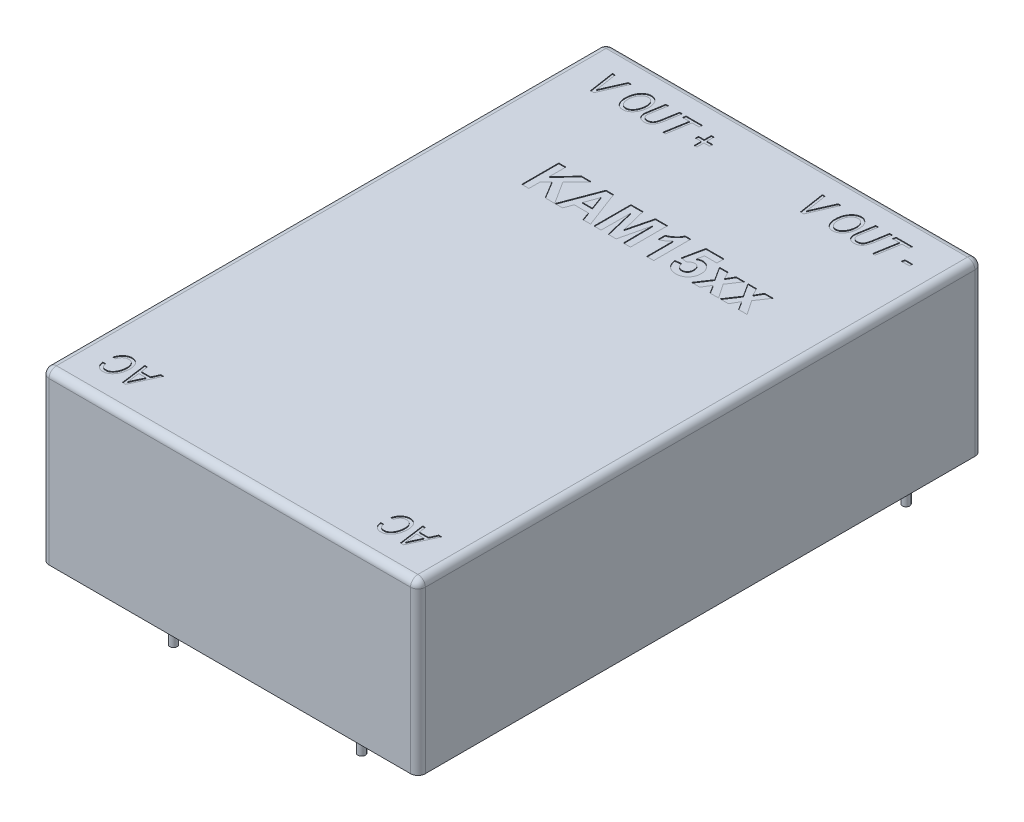
from build123d import *

# Parameters (mm, degrees)
SKETCH_1_W          = 50.8
SKETCH_1_H          = 76.2
EXTRUDE_1_DEPTH     = 22.8
FILLET_1_R          = 1
SKETCH_2_R          = 0.5
EXTRUDE_2_DEPTH     = 6
CUT_EXTRUDE_1_DEPTH = 0.1


with BuildPart() as part:
    # Эскиз1 → Бобышка-Вытянуть1 (new body)
    with BuildSketch(Plane(origin=(0, 0, 0), x_dir=(1, 0, 0), z_dir=(0, 1, 0))):
        Rectangle(SKETCH_1_W, SKETCH_1_H)
    extrude(amount=EXTRUDE_1_DEPTH)

    # Скругление1
    fillet_1_edges = [part.edges().sort_by_distance(p)[0] for p in [
        (-25.4, 22.8, 0),
        (0, 22.8, 38.1),
        (25.4, 22.8, 0),
        (25.4, 11.4, 38.1),
        (-25.4, 11.4, 38.1),
        (-25.4, 11.4, -38.1),
        (25.4, 11.4, -38.1),
        (0, 22.8, -38.1),
    ]]
    fillet(fillet_1_edges, radius=FILLET_1_R)

    # Эскиз2 → Бобышка-Вытянуть2 (add)
    with BuildSketch(Plane.XZ):
        with Locations(Location((-12.7, 33, 0), (0, 0, 270))):
            Circle(SKETCH_2_R)
        with Locations(Location((12.7, 33, 0), (0, 0, 270))):
            Circle(SKETCH_2_R)
        with Locations(Location((-20.3, -32.9, 0), (0, 0, 270))):
            Circle(SKETCH_2_R)
        with Locations(Location((20.3, -32.9, 0), (0, 0, 270))):
            Circle(SKETCH_2_R)
        with Locations(Location((12.7, -22.9, 0), (0, 0, 270))):
            Circle(SKETCH_2_R)
    extrude(amount=EXTRUDE_2_DEPTH)

    # Эскиз4 → Вырез-Вытянуть1 (cut)
    # profile 1 of 21: a face of its own
    with BuildSketch(Plane(origin=(0, 22.8, 0), x_dir=(1, 0, 0), z_dir=(0, 1, 0))):
        with BuildLine():
            Line((-20.508135671, 31.1), (-21.043647035, 34.6))
            Line((-21.043647035, 34.6), (-20.676459535, 34.6))
            Line((-20.676459535, 34.6), (-20.339101581, 32.515482955))
            add(Edge.make_bspline(
                [(-20.339101581, 32.515482955), (-20.331483865, 32.469325449), (-20.316647383, 32.379427772), (-20.295656086, 32.247886285), (-20.278422798, 32.12297363), (-20.261767712, 32.005151321), (-20.247525486, 31.894115019), (-20.235477548, 31.78993832), (-20.225372534, 31.69264127), (-20.220158896, 31.630075275), (-20.217652717, 31.6)],
                knots=[0, 0, 0, 0, 1.215428348, 2.367203002, 3.460592293, 4.49136193, 5.458724188, 6.368902806, 7.215936773, 8, 8, 8, 8], degree=3))
            add(Edge.make_bspline(
                [(-20.217652717, 31.6), (-20.20269006, 31.636912442), (-20.173640112, 31.708577822), (-20.132100289, 31.813321078), (-20.091297327, 31.911344032), (-20.053086857, 32.003158999), (-20.017709037, 32.089117635), (-19.983119768, 32.168249558), (-19.952666314, 32.242189058), (-19.931555804, 32.288737826), (-19.921487944, 32.3109375)],
                knots=[0, 0, 0, 0, 1.24111471, 2.409619975, 3.511069504, 4.549526078, 5.508537314, 6.407443404, 7.240490386, 8, 8, 8, 8], degree=3))
            Line((-19.921487944, 32.3109375), (-18.906573171, 34.6))
            Line((-18.906573171, 34.6), (-18.514527717, 34.6))
            Line((-18.514527717, 34.6), (-20.043647035, 31.1))
            Line((-20.043647035, 31.1), (-20.508135671, 31.1))
        make_face()
    # profile 2 of 21: a face of its own
    with BuildSketch(Plane(origin=(0, 22.8, 0), x_dir=(1, 0, 0), z_dir=(0, 1, 0))):
        with BuildLine():
            add(Edge.make_bspline(
                [(-17.331289081, 32.568039773), (-17.329729, 32.645741847), (-17.326678472, 32.797677857), (-17.304587444, 33.020190907), (-17.26725737, 33.231345515), (-17.214568685, 33.431390348), (-17.147273751, 33.620292149), (-17.064449713, 33.797810306), (-16.967627949, 33.964806365), (-16.89037726, 34.06641638), (-16.851885671, 34.117045455)],
                knots=[0, 0, 0, 0, 1.127803926, 2.205269675, 3.242032255, 4.237287615, 5.204708158, 6.148693905, 7.077552404, 8, 8, 8, 8], degree=3))
            add(Edge.make_bspline(
                [(-16.851885671, 34.117045455), (-16.816226324, 34.158977067), (-16.746363609, 34.241128215), (-16.630446669, 34.349106073), (-16.508435337, 34.440382773), (-16.381083874, 34.515763214), (-16.246963608, 34.573305474), (-16.107639228, 34.616130913), (-15.961859034, 34.640218158), (-15.862859057, 34.64369653), (-15.812823171, 34.645454545)],
                knots=[0, 0, 0, 0, 1.093059416, 2.141488976, 3.139706554, 4.115923473, 5.074573365, 6.032946217, 7.005825244, 8, 8, 8, 8], degree=3))
            add(Edge.make_bspline(
                [(-15.812823171, 34.645454545), (-15.770615129, 34.644249358), (-15.687642854, 34.641880208), (-15.565954227, 34.62248585), (-15.450023093, 34.589078972), (-15.338491425, 34.544742173), (-15.232894603, 34.485785375), (-15.132822546, 34.414078237), (-15.038069231, 34.329613302), (-14.94888847, 34.233257631), (-14.867121973, 34.125797299), (-14.796484325, 34.006759515), (-14.737128845, 33.877818537), (-14.687638689, 33.739135495), (-14.650523454, 33.590125374), (-14.623784004, 33.431274997), (-14.607212909, 33.262517958), (-14.605100601, 33.146677066), (-14.604016353, 33.087215909)],
                knots=[0, 0, 0, 0, 0.916381921, 1.801417193, 2.667292183, 3.532327148, 4.402283747, 5.28688579, 6.201072574, 7.15431746, 8.134323617, 9.128098643, 10.154072632, 11.212764668, 12.321382489, 13.484497127, 14.708791779, 16, 16, 16, 16], degree=3))
            add(Edge.make_bspline(
                [(-14.604016353, 33.087215909), (-14.604691725, 33.038664655), (-14.606030933, 32.942391309), (-14.616913161, 32.799904384), (-14.634671, 32.660751256), (-14.659381437, 32.525084859), (-14.691597769, 32.392900884), (-14.729746043, 32.263688257), (-14.775814432, 32.138205588), (-14.829378269, 32.01722137), (-14.886878686, 31.901233601), (-14.949495096, 31.792518515), (-15.015678411, 31.69127099), (-15.085394058, 31.597354839), (-15.158331141, 31.510189347), (-15.236195309, 31.431386711), (-15.316969183, 31.35922971), (-15.401773192, 31.295599587), (-15.488204683, 31.238627564), (-15.576464038, 31.18934751), (-15.666182207, 31.148319952), (-15.756423161, 31.113819706), (-15.848170159, 31.087432628), (-15.940970705, 31.068267558), (-16.035054126, 31.056443615), (-16.098064311, 31.055178377), (-16.129584535, 31.054545455)],
                knots=[0, 0, 0, 0, 1.243107213, 2.464984574, 3.656776216, 4.833923535, 5.994010872, 7.139048478, 8.282110565, 9.414059015, 10.525597339, 11.595577003, 12.62458755, 13.621214304, 14.589126716, 15.532212535, 16.455509691, 17.35998751, 18.244394592, 19.104641205, 19.945509776, 20.768554808, 21.576275972, 22.387107742, 23.193166529, 24, 24, 24, 24], degree=3))
            add(Edge.make_bspline(
                [(-16.129584535, 31.054545455), (-16.156822212, 31.055175339), (-16.210934125, 31.056426704), (-16.291061539, 31.063859126), (-16.368992252, 31.078646893), (-16.444736489, 31.097579779), (-16.51879516, 31.121715429), (-16.590208662, 31.152571732), (-16.660165993, 31.188033516), (-16.727753364, 31.229165596), (-16.792288919, 31.276584316), (-16.855350605, 31.328034343), (-16.913913804, 31.386601709), (-16.969857605, 31.450462343), (-17.022813436, 31.519714271), (-17.072694102, 31.59478263), (-17.119550371, 31.67522479), (-17.163347661, 31.760726227), (-17.203329042, 31.850617091), (-17.236847996, 31.9443729), (-17.266646935, 32.040638694), (-17.289409438, 32.140502878), (-17.309234571, 32.242922687), (-17.32144698, 32.348820791), (-17.329575816, 32.457353089), (-17.330713526, 32.530855672), (-17.331289081, 32.568039773)],
                knots=[0, 0, 0, 0, 0.908820226, 1.805513784, 2.680768494, 3.552345122, 4.409015119, 5.275999182, 6.144923694, 7.024018507, 7.911868475, 8.814904803, 9.73640305, 10.671074866, 11.645735184, 12.642418782, 13.675972089, 14.749781779, 15.846012825, 16.955338643, 18.069657785, 19.205681351, 20.370577349, 21.548095973, 22.759610301, 24, 24, 24, 24], degree=3))
        make_face()
        with BuildLine():
            add(Edge.make_bspline(
                [(-16.967652717, 32.550994318), (-16.96682723, 32.510716266), (-16.965216101, 32.432104338), (-16.952865645, 32.317197392), (-16.933205495, 32.208403146), (-16.905764307, 32.105532051), (-16.869323964, 32.009307617), (-16.825237758, 31.919310039), (-16.77297865, 31.835484553), (-16.713201458, 31.758580159), (-16.646936504, 31.690529648), (-16.579132272, 31.628998046), (-16.506553871, 31.578750068), (-16.432101767, 31.536034674), (-16.353781351, 31.504309483), (-16.273073046, 31.480179963), (-16.188971226, 31.466873204), (-16.1319939, 31.464720326), (-16.103306126, 31.463636364)],
                knots=[0, 0, 0, 0, 1.248215484, 2.436180984, 3.577521359, 4.672242816, 5.73118744, 6.761629965, 7.77356525, 8.787839044, 9.773903131, 10.714783555, 11.620706577, 12.504486547, 13.369795965, 14.233610676, 15.110632581, 16, 16, 16, 16], degree=3))
            add(Edge.make_bspline(
                [(-16.103306126, 31.463636364), (-16.081013128, 31.464094332), (-16.036469986, 31.46500939), (-15.970094402, 31.475207842), (-15.90385133, 31.488835974), (-15.83803362, 31.509775799), (-15.772908927, 31.537254573), (-15.707147657, 31.568796109), (-15.642575152, 31.607820729), (-15.577859433, 31.65154529), (-15.514434134, 31.701831992), (-15.454212819, 31.759915069), (-15.39565261, 31.824051064), (-15.339914563, 31.894801106), (-15.286809076, 31.972412324), (-15.236853078, 32.056916085), (-15.188484359, 32.147795587), (-15.143172293, 32.244643353), (-15.102503369, 32.346238147), (-15.066055737, 32.450632365), (-15.035406417, 32.557559071), (-15.010762262, 32.66666902), (-14.991325292, 32.778060409), (-14.978229009, 32.891901796), (-14.969224529, 33.008000003), (-14.968178353, 33.086251738), (-14.967652717, 33.125568182)],
                knots=[0, 0, 0, 0, 0.724125538, 1.446859076, 2.178997931, 2.921420815, 3.687522046, 4.475765194, 5.290176887, 6.137665819, 7.013918117, 7.91759318, 8.854671445, 9.835514552, 10.843138707, 11.909652298, 13.025193244, 14.188994346, 15.383812143, 16.581353597, 17.782327931, 18.997814299, 20.216318458, 21.456410356, 22.722010469, 24, 24, 24, 24], degree=3))
            add(Edge.make_bspline(
                [(-14.967652717, 33.125568182), (-14.968583719, 33.167490214), (-14.970401872, 33.249359752), (-14.981240619, 33.368668098), (-15.001789383, 33.48100585), (-15.027811223, 33.586895346), (-15.063847918, 33.685663776), (-15.107185113, 33.777386838), (-15.157536366, 33.862891325), (-15.216730405, 33.939879704), (-15.280981496, 34.009003235), (-15.348636164, 34.070126573), (-15.419971651, 34.121329411), (-15.494153042, 34.164070602), (-15.572488178, 34.195826734), (-15.653506014, 34.219707061), (-15.738274231, 34.233226877), (-15.795732448, 34.235307537), (-15.824897035, 34.236363636)],
                knots=[0, 0, 0, 0, 1.283645288, 2.506830938, 3.662733379, 4.777264101, 5.841126734, 6.875393576, 7.879767937, 8.872779993, 9.842099287, 10.766050559, 11.659182214, 12.525834414, 13.380553688, 14.240756407, 15.107044823, 16, 16, 16, 16], degree=3))
            add(Edge.make_bspline(
                [(-15.824897035, 34.236363636), (-15.858823862, 34.235033272), (-15.926191491, 34.232391601), (-16.026042375, 34.214212878), (-16.123042666, 34.183407698), (-16.217518743, 34.140187044), (-16.309467192, 34.085197741), (-16.398479226, 34.017804191), (-16.484969013, 33.938520288), (-16.538246492, 33.878669602), (-16.565664081, 33.847869318)],
                knots=[0, 0, 0, 0, 0.941820609, 1.870148977, 2.807716515, 3.760800976, 4.74830641, 5.776348317, 6.85566718, 8, 8, 8, 8], degree=3))
            add(Edge.make_bspline(
                [(-16.565664081, 33.847869318), (-16.598066789, 33.806854917), (-16.66309119, 33.724548931), (-16.74480254, 33.587976449), (-16.813661139, 33.441296534), (-16.869920079, 33.283776407), (-16.91360838, 33.115695201), (-16.945690024, 32.936964322), (-16.963957611, 32.747399628), (-16.966400412, 32.617557881), (-16.967652717, 32.550994318)],
                knots=[0, 0, 0, 0, 0.904305924, 1.814723344, 2.748107558, 3.706329986, 4.706586589, 5.751909651, 6.847513167, 8, 8, 8, 8], degree=3))
        make_face(mode=Mode.SUBTRACT)
    # profile 3 of 21: a face of its own
    with BuildSketch(Plane(origin=(0, 22.8, 0), x_dir=(1, 0, 0), z_dir=(0, 1, 0))):
        with BuildLine():
            Line((-13.830578853, 34.6), (-13.461970899, 34.6))
            Line((-13.461970899, 34.6), (-13.824186808, 32.460085227))
            add(Edge.make_bspline(
                [(-13.824186808, 32.460085227), (-13.831055422, 32.419401305), (-13.843810471, 32.343851063), (-13.858071169, 32.238470289), (-13.867493058, 32.149647783), (-13.868976283, 32.095755787), (-13.869641353, 32.071590909)],
                knots=[0, 0, 0, 0, 1.264473255, 2.348132976, 3.259311823, 4, 4, 4, 4], degree=3))
            add(Edge.make_bspline(
                [(-13.869641353, 32.071590909), (-13.869132684, 32.05001587), (-13.868139105, 32.007873557), (-13.85924464, 31.946042401), (-13.845229749, 31.886974914), (-13.825138982, 31.830603832), (-13.799850797, 31.776851276), (-13.767004482, 31.727115247), (-13.730228361, 31.679161851), (-13.687695605, 31.634549334), (-13.640451049, 31.59449458), (-13.58970844, 31.559199555), (-13.535220414, 31.530058736), (-13.477609504, 31.506019707), (-13.416876089, 31.486517072), (-13.352610836, 31.473158973), (-13.285079485, 31.465392159), (-13.238979807, 31.464228494), (-13.215522035, 31.463636364)],
                knots=[0, 0, 0, 0, 1.033877598, 2.01946298, 2.988504879, 3.939836088, 4.884099159, 5.828635058, 6.791274408, 7.778753327, 8.77719556, 9.756354995, 10.736500724, 11.733587211, 12.745868882, 13.789914387, 14.875400268, 16, 16, 16, 16], degree=3))
            add(Edge.make_bspline(
                [(-13.215522035, 31.463636364), (-13.184458842, 31.46437188), (-13.123446142, 31.465816541), (-13.034098345, 31.479672102), (-12.949355929, 31.502398604), (-12.868889069, 31.533757558), (-12.793306542, 31.574681072), (-12.721777855, 31.624060384), (-12.65437571, 31.682304302), (-12.61485935, 31.727570881), (-12.594783399, 31.750568182)],
                knots=[0, 0, 0, 0, 1.052741862, 2.067740481, 3.056983388, 4.022989397, 4.989162175, 5.964496339, 6.965879637, 8, 8, 8, 8], degree=3))
            add(Edge.make_bspline(
                [(-12.594783399, 31.750568182), (-12.579332659, 31.771051811), (-12.546118986, 31.815084433), (-12.504457873, 31.894065662), (-12.463404352, 31.987063406), (-12.424619756, 32.095630399), (-12.38808395, 32.219246068), (-12.353511941, 32.357915384), (-12.320963946, 32.511723837), (-12.301627277, 32.61959153), (-12.291516353, 32.675994318)],
                knots=[0, 0, 0, 0, 0.625993321, 1.345666195, 2.174327788, 3.109296381, 4.159711475, 5.322674786, 6.600057134, 8, 8, 8, 8], degree=3))
            Line((-12.291516353, 32.675994318), (-11.96694249, 34.6))
            Line((-11.96694249, 34.6), (-11.599044762, 34.6))
            Line((-11.599044762, 34.6), (-11.944215217, 32.555965909))
            add(Edge.make_bspline(
                [(-11.944215217, 32.555965909), (-11.95269711, 32.508091228), (-11.969158072, 32.41517998), (-11.997712001, 32.280673229), (-12.028099108, 32.155107238), (-12.060309609, 32.038314051), (-12.096329888, 31.931056551), (-12.132562615, 31.832004918), (-12.172342267, 31.742395758), (-12.214812139, 31.661312691), (-12.25903555, 31.586775626), (-12.306004023, 31.517935886), (-12.354984048, 31.453825143), (-12.406422704, 31.394497114), (-12.460267191, 31.339658703), (-12.517140998, 31.289969022), (-12.576410451, 31.245147376), (-12.657365405, 31.191114526), (-12.76505349, 31.1360262), (-12.902531486, 31.088837572), (-13.047608852, 31.059451223), (-13.147201004, 31.056197466), (-13.197766353, 31.054545455)],
                knots=[0, 0, 0, 0, 1.354048009, 2.627825151, 3.828822134, 4.951889091, 6.000672138, 6.979203555, 7.888343454, 8.72885464, 9.527187123, 10.30076657, 11.048512718, 11.772989406, 12.486339174, 13.187239136, 13.874294499, 14.554577546, 15.89632083, 17.228748768, 18.592968593, 20, 20, 20, 20], degree=3))
            add(Edge.make_bspline(
                [(-13.197766353, 31.054545455), (-13.236630831, 31.055306166), (-13.312213878, 31.056785585), (-13.422450524, 31.069937691), (-13.526404645, 31.09090771), (-13.624378174, 31.120948291), (-13.716250758, 31.158985995), (-13.80154747, 31.20650277), (-13.880765705, 31.261981813), (-13.953145233, 31.325872194), (-14.017914137, 31.397265639), (-14.074963899, 31.47462075), (-14.122902357, 31.558258801), (-14.161077555, 31.647882894), (-14.191834215, 31.742658106), (-14.213905732, 31.843467582), (-14.226654707, 31.950284451), (-14.228217282, 32.02349766), (-14.229016353, 32.0609375)],
                knots=[0, 0, 0, 0, 1.144687927, 2.226171758, 3.265818346, 4.265309611, 5.240757149, 6.189914275, 7.136196561, 8.085020447, 9.028109652, 9.971198856, 10.911627501, 11.861399532, 12.836373122, 13.843356948, 14.897133859, 16, 16, 16, 16], degree=3))
            add(Edge.make_bspline(
                [(-14.229016353, 32.0609375), (-14.228646696, 32.077749783), (-14.227849488, 32.114007418), (-14.224219054, 32.172535957), (-14.217440106, 32.239256832), (-14.209221692, 32.314382006), (-14.197373003, 32.397631498), (-14.184231109, 32.489108232), (-14.167512044, 32.588685784), (-14.155649295, 32.657769557), (-14.149470899, 32.69375)],
                knots=[0, 0, 0, 0, 0.63216751, 1.363342453, 2.203790688, 3.15324204, 4.204261713, 5.364778941, 6.627515302, 8, 8, 8, 8], degree=3))
            Line((-14.149470899, 32.69375), (-13.830578853, 34.6))
        make_face()
    # profile 4 of 21: a face of its own
    with BuildSketch(Plane(origin=(0, 22.8, 0), x_dir=(1, 0, 0), z_dir=(0, 1, 0))):
        Polygon((-10.773050444, 31.1), (-10.247482262, 34.190909091), (-11.165095899, 34.190909091), (-11.091232262, 34.6), (-8.876743626, 34.6), (-8.941374308, 34.190909091), (-9.878874308, 34.190909091), (-10.40444249, 31.1), align=None)
    # profile 5 of 21: a face of its own
    with BuildSketch(Plane(origin=(0, 22.8, 0), x_dir=(1, 0, 0), z_dir=(0, 1, 0))):
        Polygon((-7.104016353, 31.690909091), (-7.104016353, 32.645454545), (-7.876743626, 32.645454545), (-7.876743626, 33.054545455), (-7.104016353, 33.054545455), (-7.104016353, 34.009090909), (-6.74037999, 34.009090909), (-6.74037999, 33.054545455), (-5.967652717, 33.054545455), (-5.967652717, 32.645454545), (-6.74037999, 32.645454545), (-6.74037999, 31.690909091), align=None)
    # profile 6 of 21: a face of its own
    with BuildSketch(Plane(origin=(0, 22.8, 0), x_dir=(1, 0, 0), z_dir=(0, 1, 0))):
        Polygon((20.422198171, 32.145454545), (20.495351581, 32.554545455), (21.562823171, 32.554545455), (21.489669762, 32.145454545), align=None)
    # profile 7 of 21: a face of its own
    with BuildSketch(Plane(origin=(0, 22.8, 0), x_dir=(1, 0, 0), z_dir=(0, 1, 0))):
        Polygon((17.571345899, 31.1), (18.096914081, 34.190909091), (17.179300444, 34.190909091), (17.253164081, 34.6), (19.467652717, 34.6), (19.403022035, 34.190909091), (18.465522035, 34.190909091), (17.939953853, 31.1), align=None)
    # profile 8 of 21: a face of its own
    with BuildSketch(Plane(origin=(0, 22.8, 0), x_dir=(1, 0, 0), z_dir=(0, 1, 0))):
        with BuildLine():
            Line((14.51381749, 34.6), (14.882425444, 34.6))
            Line((14.882425444, 34.6), (14.520209535, 32.460085227))
            add(Edge.make_bspline(
                [(14.520209535, 32.460085227), (14.513340921, 32.419401305), (14.500585872, 32.343851063), (14.486325174, 32.238470289), (14.476903285, 32.149647783), (14.47542006, 32.095755787), (14.47475499, 32.071590909)],
                knots=[0, 0, 0, 0, 1.264473255, 2.348132976, 3.259311823, 4, 4, 4, 4], degree=3))
            add(Edge.make_bspline(
                [(14.47475499, 32.071590909), (14.475263659, 32.05001587), (14.476257238, 32.007873557), (14.485151703, 31.946042401), (14.499166594, 31.886974914), (14.519257361, 31.830603832), (14.544545546, 31.776851276), (14.577391861, 31.727115247), (14.614167982, 31.679161851), (14.656700738, 31.634549334), (14.703945294, 31.59449458), (14.754687903, 31.559199555), (14.809175929, 31.530058736), (14.866786839, 31.506019707), (14.927520254, 31.486517072), (14.991785507, 31.473158973), (15.059316858, 31.465392159), (15.105416536, 31.464228494), (15.128874308, 31.463636364)],
                knots=[0, 0, 0, 0, 1.033877598, 2.01946298, 2.988504879, 3.939836088, 4.884099159, 5.828635058, 6.791274408, 7.778753327, 8.77719556, 9.756354995, 10.736500724, 11.733587211, 12.745868882, 13.789914387, 14.875400268, 16, 16, 16, 16], degree=3))
            add(Edge.make_bspline(
                [(15.128874308, 31.463636364), (15.159937501, 31.46437188), (15.220950201, 31.465816541), (15.310297998, 31.479672102), (15.395040414, 31.502398604), (15.475507274, 31.533757558), (15.551089801, 31.574681072), (15.622618488, 31.624060384), (15.690020633, 31.682304302), (15.729536993, 31.727570881), (15.749612944, 31.750568182)],
                knots=[0, 0, 0, 0, 1.052741862, 2.067740481, 3.056983388, 4.022989397, 4.989162175, 5.964496339, 6.965879637, 8, 8, 8, 8], degree=3))
            add(Edge.make_bspline(
                [(15.749612944, 31.750568182), (15.765063684, 31.771051811), (15.798277357, 31.815084433), (15.83993847, 31.894065662), (15.880991991, 31.987063406), (15.919776587, 32.095630399), (15.956312393, 32.219246068), (15.990884402, 32.357915384), (16.023432397, 32.511723837), (16.042769066, 32.61959153), (16.05287999, 32.675994318)],
                knots=[0, 0, 0, 0, 0.625993321, 1.345666195, 2.174327788, 3.109296381, 4.159711475, 5.322674786, 6.600057134, 8, 8, 8, 8], degree=3))
            Line((16.05287999, 32.675994318), (16.377453853, 34.6))
            Line((16.377453853, 34.6), (16.745351581, 34.6))
            Line((16.745351581, 34.6), (16.400181126, 32.555965909))
            add(Edge.make_bspline(
                [(16.400181126, 32.555965909), (16.391699233, 32.508091228), (16.375238271, 32.41517998), (16.346684341, 32.280673229), (16.316297235, 32.155107238), (16.284086734, 32.038314051), (16.248066455, 31.931056551), (16.211833728, 31.832004918), (16.172054076, 31.742395758), (16.129584204, 31.661312691), (16.085360793, 31.586775626), (16.038392319, 31.517935886), (15.989412295, 31.453825143), (15.937973639, 31.394497114), (15.884129152, 31.339658703), (15.827255345, 31.289969022), (15.767985892, 31.245147376), (15.687030938, 31.191114526), (15.579342853, 31.1360262), (15.441864857, 31.088837572), (15.296787491, 31.059451223), (15.197195339, 31.056197466), (15.14662999, 31.054545455)],
                knots=[0, 0, 0, 0, 1.354048009, 2.627825151, 3.828822134, 4.951889091, 6.000672138, 6.979203555, 7.888343454, 8.72885464, 9.527187123, 10.30076657, 11.048512718, 11.772989406, 12.486339174, 13.187239136, 13.874294499, 14.554577546, 15.89632083, 17.228748768, 18.592968593, 20, 20, 20, 20], degree=3))
            add(Edge.make_bspline(
                [(15.14662999, 31.054545455), (15.107765512, 31.055306166), (15.032182465, 31.056785585), (14.921945819, 31.069937691), (14.817991698, 31.09090771), (14.720018169, 31.120948291), (14.628145585, 31.158985995), (14.542848873, 31.20650277), (14.463630638, 31.261981813), (14.39125111, 31.325872194), (14.326482206, 31.397265639), (14.269432444, 31.47462075), (14.221493985, 31.558258801), (14.183318788, 31.647882894), (14.152562128, 31.742658106), (14.130490611, 31.843467582), (14.117741636, 31.950284451), (14.116179061, 32.02349766), (14.11537999, 32.0609375)],
                knots=[0, 0, 0, 0, 1.144687927, 2.226171758, 3.265818346, 4.265309611, 5.240757149, 6.189914275, 7.136196561, 8.085020447, 9.028109652, 9.971198856, 10.911627501, 11.861399532, 12.836373122, 13.843356948, 14.897133859, 16, 16, 16, 16], degree=3))
            add(Edge.make_bspline(
                [(14.11537999, 32.0609375), (14.115749647, 32.077749783), (14.116546855, 32.114007418), (14.120177289, 32.172535957), (14.126956237, 32.239256832), (14.135174651, 32.314382006), (14.14702334, 32.397631498), (14.160165234, 32.489108232), (14.176884299, 32.588685784), (14.188747048, 32.657769557), (14.194925444, 32.69375)],
                knots=[0, 0, 0, 0, 0.63216751, 1.363342453, 2.203790688, 3.15324204, 4.204261713, 5.364778941, 6.627515302, 8, 8, 8, 8], degree=3))
            Line((14.194925444, 32.69375), (14.51381749, 34.6))
        make_face()
    # profile 9 of 21: a face of its own
    with BuildSketch(Plane(origin=(0, 22.8, 0), x_dir=(1, 0, 0), z_dir=(0, 1, 0))):
        with BuildLine():
            add(Edge.make_bspline(
                [(11.013107262, 32.568039773), (11.014667343, 32.645741847), (11.017717871, 32.797677857), (11.039808899, 33.020190907), (11.077138973, 33.231345515), (11.129827658, 33.431390348), (11.197122592, 33.620292149), (11.27994663, 33.797810306), (11.376768394, 33.964806365), (11.454019083, 34.06641638), (11.492510671, 34.117045455)],
                knots=[0, 0, 0, 0, 1.127803926, 2.205269675, 3.242032255, 4.237287615, 5.204708158, 6.148693905, 7.077552404, 8, 8, 8, 8], degree=3))
            add(Edge.make_bspline(
                [(11.492510671, 34.117045455), (11.528170018, 34.158977067), (11.598032734, 34.241128215), (11.713949674, 34.349106073), (11.835961006, 34.440382773), (11.963312469, 34.515763214), (12.097432735, 34.573305474), (12.236757115, 34.616130913), (12.382537309, 34.640218158), (12.481537286, 34.64369653), (12.531573171, 34.645454545)],
                knots=[0, 0, 0, 0, 1.093059416, 2.141488976, 3.139706554, 4.115923473, 5.074573365, 6.032946217, 7.005825244, 8, 8, 8, 8], degree=3))
            add(Edge.make_bspline(
                [(12.531573171, 34.645454545), (12.573781214, 34.644249358), (12.656753489, 34.641880208), (12.778442116, 34.62248585), (12.89437325, 34.589078972), (13.005904918, 34.544742173), (13.11150174, 34.485785375), (13.211573797, 34.414078237), (13.306327111, 34.329613302), (13.395507873, 34.233257631), (13.47727437, 34.125797299), (13.547912018, 34.006759515), (13.607267498, 33.877818537), (13.656757654, 33.739135495), (13.693872889, 33.590125374), (13.720612339, 33.431274997), (13.737183434, 33.262517958), (13.739295741, 33.146677066), (13.74037999, 33.087215909)],
                knots=[0, 0, 0, 0, 0.916381921, 1.801417193, 2.667292183, 3.532327148, 4.402283747, 5.28688579, 6.201072574, 7.15431746, 8.134323617, 9.128098643, 10.154072632, 11.212764668, 12.321382489, 13.484497127, 14.708791779, 16, 16, 16, 16], degree=3))
            add(Edge.make_bspline(
                [(13.74037999, 33.087215909), (13.739704618, 33.038664655), (13.73836541, 32.942391309), (13.727483182, 32.799904384), (13.709725343, 32.660751256), (13.685014906, 32.525084859), (13.652798573, 32.392900884), (13.6146503, 32.263688257), (13.568581911, 32.138205588), (13.515018074, 32.01722137), (13.457517657, 31.901233601), (13.394901246, 31.792518515), (13.328717932, 31.69127099), (13.259002285, 31.597354839), (13.186065202, 31.510189347), (13.108201034, 31.431386711), (13.02742716, 31.35922971), (12.942623151, 31.295599587), (12.85619166, 31.238627564), (12.767932305, 31.18934751), (12.678214136, 31.148319952), (12.587973182, 31.113819706), (12.496226184, 31.087432628), (12.403425638, 31.068267558), (12.309342217, 31.056443615), (12.246332032, 31.055178377), (12.214811808, 31.054545455)],
                knots=[0, 0, 0, 0, 1.243107213, 2.464984574, 3.656776216, 4.833923535, 5.994010872, 7.139048478, 8.282110565, 9.414059015, 10.525597339, 11.595577003, 12.62458755, 13.621214304, 14.589126716, 15.532212535, 16.455509691, 17.35998751, 18.244394592, 19.104641205, 19.945509776, 20.768554808, 21.576275972, 22.387107742, 23.193166529, 24, 24, 24, 24], degree=3))
            add(Edge.make_bspline(
                [(12.214811808, 31.054545455), (12.187574131, 31.055175339), (12.133462218, 31.056426704), (12.053334804, 31.063859126), (11.975404091, 31.078646893), (11.899659854, 31.097579779), (11.825601183, 31.121715429), (11.754187681, 31.152571732), (11.68423035, 31.188033516), (11.616642979, 31.229165596), (11.552107424, 31.276584316), (11.489045738, 31.328034343), (11.430482539, 31.386601709), (11.374538738, 31.450462343), (11.321582907, 31.519714271), (11.271702241, 31.59478263), (11.224845972, 31.67522479), (11.181048682, 31.760726227), (11.141067301, 31.850617091), (11.107548347, 31.9443729), (11.077749408, 32.040638694), (11.054986904, 32.140502878), (11.035161772, 32.242922687), (11.022949363, 32.348820791), (11.014820527, 32.457353089), (11.013682817, 32.530855672), (11.013107262, 32.568039773)],
                knots=[0, 0, 0, 0, 0.908820226, 1.805513784, 2.680768494, 3.552345122, 4.409015119, 5.275999182, 6.144923694, 7.024018507, 7.911868475, 8.814904803, 9.73640305, 10.671074866, 11.645735184, 12.642418782, 13.675972089, 14.749781779, 15.846012825, 16.955338643, 18.069657785, 19.205681351, 20.370577349, 21.548095973, 22.759610301, 24, 24, 24, 24], degree=3))
        make_face()
        with BuildLine():
            add(Edge.make_bspline(
                [(11.376743626, 32.550994318), (11.377569113, 32.510716266), (11.379180242, 32.432104338), (11.391530698, 32.317197392), (11.411190848, 32.208403146), (11.438632036, 32.105532051), (11.475072378, 32.009307617), (11.519158585, 31.919310039), (11.571417693, 31.835484553), (11.631194885, 31.758580159), (11.697459839, 31.690529648), (11.765264071, 31.628998046), (11.837842472, 31.578750068), (11.912294576, 31.536034674), (11.990614992, 31.504309483), (12.071323297, 31.480179963), (12.155425117, 31.466873204), (12.212402443, 31.464720326), (12.241090217, 31.463636364)],
                knots=[0, 0, 0, 0, 1.248215484, 2.436180984, 3.577521359, 4.672242816, 5.73118744, 6.761629965, 7.77356525, 8.787839044, 9.773903131, 10.714783555, 11.620706577, 12.504486547, 13.369795965, 14.233610676, 15.110632581, 16, 16, 16, 16], degree=3))
            add(Edge.make_bspline(
                [(12.241090217, 31.463636364), (12.263383215, 31.464094332), (12.307926357, 31.46500939), (12.37430194, 31.475207842), (12.440545013, 31.488835974), (12.506362722, 31.509775799), (12.571487415, 31.537254573), (12.637248686, 31.568796109), (12.701821191, 31.607820729), (12.76653691, 31.65154529), (12.829962209, 31.701831992), (12.890183524, 31.759915069), (12.948743733, 31.824051064), (13.00448178, 31.894801106), (13.057587267, 31.972412324), (13.107543265, 32.056916085), (13.155911984, 32.147795587), (13.20122405, 32.244643353), (13.241892974, 32.346238147), (13.278340606, 32.450632365), (13.308989926, 32.557559071), (13.333634081, 32.66666902), (13.353071051, 32.778060409), (13.366167334, 32.891901796), (13.375171814, 33.008000003), (13.37621799, 33.086251738), (13.376743626, 33.125568182)],
                knots=[0, 0, 0, 0, 0.724125538, 1.446859076, 2.178997931, 2.921420815, 3.687522046, 4.475765194, 5.290176887, 6.137665819, 7.013918117, 7.91759318, 8.854671445, 9.835514552, 10.843138707, 11.909652298, 13.025193244, 14.188994346, 15.383812143, 16.581353597, 17.782327931, 18.997814299, 20.216318458, 21.456410356, 22.722010469, 24, 24, 24, 24], degree=3))
            add(Edge.make_bspline(
                [(13.376743626, 33.125568182), (13.375812624, 33.167490214), (13.37399447, 33.249359752), (13.363155724, 33.368668098), (13.34260696, 33.48100585), (13.31658512, 33.586895346), (13.280548425, 33.685663776), (13.23721123, 33.777386838), (13.186859977, 33.862891325), (13.127665938, 33.939879704), (13.063414847, 34.009003235), (12.995760179, 34.070126573), (12.924424692, 34.121329411), (12.850243301, 34.164070602), (12.771908165, 34.195826734), (12.690890329, 34.219707061), (12.606122112, 34.233226877), (12.548663895, 34.235307537), (12.519499308, 34.236363636)],
                knots=[0, 0, 0, 0, 1.283645288, 2.506830938, 3.662733379, 4.777264101, 5.841126734, 6.875393576, 7.879767937, 8.872779993, 9.842099287, 10.766050559, 11.659182214, 12.525834414, 13.380553688, 14.240756407, 15.107044823, 16, 16, 16, 16], degree=3))
            add(Edge.make_bspline(
                [(12.519499308, 34.236363636), (12.485572481, 34.235033272), (12.418204852, 34.232391601), (12.318353968, 34.214212878), (12.221353677, 34.183407698), (12.1268776, 34.140187044), (12.03492915, 34.085197741), (11.945917117, 34.017804191), (11.85942733, 33.938520288), (11.806149851, 33.878669602), (11.778732262, 33.847869318)],
                knots=[0, 0, 0, 0, 0.941820609, 1.870148977, 2.807716515, 3.760800976, 4.74830641, 5.776348317, 6.85566718, 8, 8, 8, 8], degree=3))
            add(Edge.make_bspline(
                [(11.778732262, 33.847869318), (11.746329554, 33.806854917), (11.681305153, 33.724548931), (11.599593803, 33.587976449), (11.530735204, 33.441296534), (11.474476264, 33.283776407), (11.430787963, 33.115695201), (11.398706319, 32.936964322), (11.380438732, 32.747399628), (11.377995931, 32.617557881), (11.376743626, 32.550994318)],
                knots=[0, 0, 0, 0, 0.904305924, 1.814723344, 2.748107558, 3.706329986, 4.706586589, 5.751909651, 6.847513167, 8, 8, 8, 8], degree=3))
        make_face(mode=Mode.SUBTRACT)
    # profile 10 of 21: a face of its own
    with BuildSketch(Plane(origin=(0, 22.8, 0), x_dir=(1, 0, 0), z_dir=(0, 1, 0))):
        with BuildLine():
            Line((7.836260671, 31.1), (7.300749308, 34.6))
            Line((7.300749308, 34.6), (7.667936808, 34.6))
            Line((7.667936808, 34.6), (8.005294762, 32.515482955))
            add(Edge.make_bspline(
                [(8.005294762, 32.515482955), (8.012912478, 32.469325449), (8.02774896, 32.379427772), (8.048740257, 32.247886285), (8.065973545, 32.12297363), (8.082628631, 32.005151321), (8.096870857, 31.894115019), (8.108918795, 31.78993832), (8.119023809, 31.69264127), (8.124237447, 31.630075275), (8.126743626, 31.6)],
                knots=[0, 0, 0, 0, 1.215428348, 2.367203002, 3.460592293, 4.49136193, 5.458724188, 6.368902806, 7.215936773, 8, 8, 8, 8], degree=3))
            add(Edge.make_bspline(
                [(8.126743626, 31.6), (8.141706283, 31.636912442), (8.170756231, 31.708577822), (8.212296053, 31.813321078), (8.253099016, 31.911344032), (8.291309486, 32.003158999), (8.326687306, 32.089117635), (8.361276575, 32.168249558), (8.391730028, 32.242189058), (8.412840539, 32.288737826), (8.422908399, 32.3109375)],
                knots=[0, 0, 0, 0, 1.24111471, 2.409619975, 3.511069504, 4.549526078, 5.508537314, 6.407443404, 7.240490386, 8, 8, 8, 8], degree=3))
            Line((8.422908399, 32.3109375), (9.437823171, 34.6))
            Line((9.437823171, 34.6), (9.829868626, 34.6))
            Line((9.829868626, 34.6), (8.300749308, 31.1))
            Line((8.300749308, 31.1), (7.836260671, 31.1))
        make_face()
    # profile 11 of 21: a face of its own
    with BuildSketch(Plane(origin=(0, 22.8, 0), x_dir=(1, 0, 0), z_dir=(0, 1, 0))):
        Polygon((21.606147035, -31.1), (19.980436808, -34.6), (19.535834535, -34.6), (19.056431126, -31.1), (19.422198171, -31.1), (19.539385671, -32.054545455), (20.782283399, -32.054545455), (21.211970899, -31.1), align=None)
        with BuildLine():
            Line((20.582709535, -32.463636364), (19.590522035, -32.463636364))
            Line((19.590522035, -32.463636364), (19.716232262, -33.344318182))
            add(Edge.make_bspline(
                [(19.716232262, -33.344318182), (19.722265473, -33.3869165), (19.734055459, -33.470161334), (19.749435184, -33.592624078), (19.763918886, -33.709518094), (19.77583353, -33.821311783), (19.786497414, -33.927846492), (19.795953726, -34.029140435), (19.802931457, -34.125059842), (19.806724104, -34.187117724), (19.808561808, -34.2171875)],
                knots=[0, 0, 0, 0, 1.176028314, 2.298172428, 3.373764291, 4.395708472, 5.371255726, 6.300478045, 7.17650679, 8, 8, 8, 8], degree=3))
            add(Edge.make_bspline(
                [(19.808561808, -34.2171875), (19.826393193, -34.164487477), (19.863925855, -34.053561037), (19.931300598, -33.882018572), (20.010526828, -33.696374225), (20.068699725, -33.568626409), (20.099044762, -33.501988636)],
                knots=[0, 0, 0, 0, 0.864281254, 1.819195492, 2.862415363, 4, 4, 4, 4], degree=3))
            Line((20.099044762, -33.501988636), (20.582709535, -32.463636364))
        make_face(mode=Mode.SUBTRACT)
    # profile 12 of 21: a face of its own
    with BuildSketch(Plane(origin=(0, 22.8, 0), x_dir=(1, 0, 0), z_dir=(0, 1, 0))):
        with BuildLine():
            Line((16.285834535, -32.327272727), (15.922198171, -32.281818182))
            add(Edge.make_bspline(
                [(15.922198171, -32.281818182), (15.938462777, -32.231910431), (15.970204908, -32.134510074), (16.025905471, -31.99480357), (16.086719076, -31.864634538), (16.153411381, -31.744145375), (16.226220551, -31.63380378), (16.303443455, -31.532367877), (16.386773206, -31.440992259), (16.475843105, -31.359924299), (16.568782532, -31.28876012), (16.663389764, -31.225331229), (16.760812548, -31.172926964), (16.860332905, -31.129764536), (16.961921108, -31.096550935), (17.065654804, -31.071950425), (17.17155864, -31.05761251), (17.242942542, -31.055569672), (17.278732262, -31.054545455)],
                knots=[0, 0, 0, 0, 1.281225819, 2.500450351, 3.669103646, 4.786795457, 5.859217893, 6.893844934, 7.896131857, 8.873922977, 9.829966374, 10.751693742, 11.651636281, 12.526661294, 13.39665172, 14.257435842, 15.126331276, 16, 16, 16, 16], degree=3))
            add(Edge.make_bspline(
                [(17.278732262, -31.054545455), (17.322117165, -31.055544105), (17.40713713, -31.057501128), (17.531219138, -31.075560146), (17.648734482, -31.105618215), (17.759977515, -31.146892459), (17.865501435, -31.199520104), (17.963682881, -31.265589397), (18.055791343, -31.342746927), (18.141165968, -31.43114085), (18.219285801, -31.530609268), (18.285768079, -31.642866583), (18.342059208, -31.766057944), (18.388023575, -31.900289994), (18.424194658, -32.045458574), (18.449214597, -32.202043165), (18.465210855, -32.369552455), (18.466823266, -32.485141377), (18.467652717, -32.544602273)],
                knots=[0, 0, 0, 0, 0.965708403, 1.892466948, 2.784987911, 3.662433543, 4.530083905, 5.404483282, 6.29145937, 7.201191451, 8.136607015, 9.101336348, 10.09920512, 11.147921061, 12.256521302, 13.426597947, 14.676198474, 16, 16, 16, 16], degree=3))
            add(Edge.make_bspline(
                [(18.467652717, -32.544602273), (18.466489093, -32.614961972), (18.464204376, -32.753109745), (18.444351192, -32.955931532), (18.413477476, -33.150588338), (18.369783248, -33.337174381), (18.311789788, -33.51529616), (18.242070623, -33.685270392), (18.161100404, -33.847958939), (18.095533685, -33.948826176), (18.062823171, -33.999147727)],
                knots=[0, 0, 0, 0, 1.101481161, 2.162703524, 3.187771491, 4.185826259, 5.160002979, 6.11756212, 7.060872506, 8, 8, 8, 8], degree=3))
            add(Edge.make_bspline(
                [(18.062823171, -33.999147727), (18.044336337, -34.025345549), (18.007962556, -34.076891087), (17.950373115, -34.150554168), (17.889888185, -34.218387374), (17.828118645, -34.282020555), (17.764045008, -34.340318636), (17.698128007, -34.393792737), (17.629639019, -34.441539314), (17.559096378, -34.483852475), (17.487363925, -34.523024122), (17.412684383, -34.555166846), (17.336408251, -34.583186839), (17.25808473, -34.605916582), (17.177875831, -34.623534487), (17.095626812, -34.636687892), (17.01132651, -34.643434458), (16.954404961, -34.644778116), (16.925749308, -34.645454545)],
                knots=[0, 0, 0, 0, 1.126561377, 2.216566401, 3.283180861, 4.318487648, 5.331293158, 6.325132532, 7.29896191, 8.261930133, 9.214639887, 10.168220823, 11.115577107, 12.068541038, 13.031257725, 13.999528834, 14.992915536, 16, 16, 16, 16], degree=3))
            add(Edge.make_bspline(
                [(16.925749308, -34.645454545), (16.889248684, -34.644711956), (16.817408467, -34.643250397), (16.712050714, -34.629459508), (16.611483461, -34.606786535), (16.515553694, -34.575068032), (16.423416881, -34.53577179), (16.336683944, -34.485487853), (16.25459436, -34.426774006), (16.177018661, -34.360271062), (16.106160154, -34.28498974), (16.042649848, -34.202171013), (15.986910929, -34.112037867), (15.93939324, -34.014707409), (15.900414825, -33.9098785), (15.868215547, -33.798177741), (15.844958695, -33.67881462), (15.835907343, -33.596529642), (15.831289081, -33.554545455)],
                knots=[0, 0, 0, 0, 1.020237255, 2.008022274, 2.965163829, 3.898827178, 4.829787759, 5.760913081, 6.695913168, 7.648741185, 8.613430446, 9.581317017, 10.562313056, 11.57188499, 12.604694656, 13.685867576, 14.819262386, 16, 16, 16, 16], degree=3))
            Line((15.831289081, -33.554545455), (16.194925444, -33.509090909))
            add(Edge.make_bspline(
                [(16.194925444, -33.509090909), (16.199971716, -33.538529628), (16.209802373, -33.59587929), (16.230796585, -33.678284094), (16.254536893, -33.755378561), (16.283116358, -33.826477906), (16.314959223, -33.892124174), (16.350599984, -33.951979065), (16.389573567, -34.00682542), (16.433923687, -34.054662335), (16.480952149, -34.098114509), (16.53240343, -34.134961797), (16.587508736, -34.166625787), (16.646678272, -34.19206613), (16.709490244, -34.212018428), (16.776084059, -34.226173218), (16.846448914, -34.234813185), (16.894710927, -34.235839513), (16.919357262, -34.236363636)],
                knots=[0, 0, 0, 0, 1.260314215, 2.455222182, 3.586725966, 4.663044931, 5.686524178, 6.663424085, 7.600938618, 8.520545945, 9.411918761, 10.299474116, 11.185734551, 12.089844691, 13.012704205, 13.963335905, 14.95992101, 16, 16, 16, 16], degree=3))
            add(Edge.make_bspline(
                [(16.919357262, -34.236363636), (16.962546546, -34.234900783), (17.047453468, -34.232024921), (17.171652415, -34.208127958), (17.289042229, -34.167582368), (17.401004977, -34.11306913), (17.505338388, -34.040500762), (17.603899619, -33.953575341), (17.694969306, -33.849858687), (17.779190073, -33.732820367), (17.855107002, -33.604910477), (17.921922572, -33.470077542), (17.978247476, -33.329197395), (18.024531249, -33.182774772), (18.059852958, -33.0302487), (18.08527328, -32.871986333), (18.101429398, -32.708054105), (18.10314666, -32.596723458), (18.104016353, -32.540340909)],
                knots=[0, 0, 0, 0, 0.903137273, 1.775500788, 2.633886985, 3.495596596, 4.372140634, 5.284507968, 6.23882919, 7.253412318, 8.297421495, 9.347417878, 10.398745308, 11.468705497, 12.557249975, 13.671236687, 14.820615767, 16, 16, 16, 16], degree=3))
            add(Edge.make_bspline(
                [(18.104016353, -32.540340909), (18.103420019, -32.497229319), (18.102261158, -32.413450203), (18.090886158, -32.291886482), (18.071647151, -32.178468655), (18.045892961, -32.072988354), (18.011680294, -31.976006402), (17.970417018, -31.887065521), (17.921501411, -31.806196237), (17.864090478, -31.734501179), (17.802010694, -31.670682946), (17.735172145, -31.615439874), (17.664681434, -31.56820481), (17.589944873, -31.529576606), (17.510832, -31.500491158), (17.428097905, -31.479037446), (17.341171064, -31.466008036), (17.281854407, -31.464434921), (17.251743626, -31.463636364)],
                knots=[0, 0, 0, 0, 1.335458309, 2.595207369, 3.77815439, 4.89713176, 5.954988326, 6.959095135, 7.930244603, 8.875310831, 9.798578304, 10.684191526, 11.556923193, 12.422971431, 13.284035535, 14.16287964, 15.067426709, 16, 16, 16, 16], degree=3))
            add(Edge.make_bspline(
                [(17.251743626, -31.463636364), (17.225663795, -31.464030419), (17.174250985, -31.464807245), (17.098544556, -31.47553634), (17.025362581, -31.490915033), (16.954141956, -31.512330071), (16.885548821, -31.54050724), (16.819926012, -31.576017207), (16.756079499, -31.616281659), (16.716424934, -31.647907004), (16.696345899, -31.663920455)],
                knots=[0, 0, 0, 0, 1.037178901, 2.044655921, 3.037082866, 4.011817109, 5.000479415, 5.982654485, 6.978519848, 8, 8, 8, 8], degree=3))
            add(Edge.make_bspline(
                [(16.696345899, -31.663920455), (16.672552056, -31.684850922), (16.62485364, -31.726809262), (16.55956528, -31.796750609), (16.499904493, -31.872172793), (16.445752646, -31.952667582), (16.397326897, -32.038500229), (16.35391974, -32.129528584), (16.316129751, -32.22614245), (16.296022442, -32.293263866), (16.285834535, -32.327272727)],
                knots=[0, 0, 0, 0, 0.959759041, 1.923984528, 2.894168648, 3.871039125, 4.860444999, 5.877572986, 6.924615546, 8, 8, 8, 8], degree=3))
        make_face()
    # profile 13 of 21: a face of its own
    with BuildSketch(Plane(origin=(0, 22.8, 0), x_dir=(1, 0, 0), z_dir=(0, 1, 0))):
        with BuildLine():
            Line((-21.24037999, -32.327272727), (-21.604016353, -32.281818182))
            add(Edge.make_bspline(
                [(-21.604016353, -32.281818182), (-21.587751748, -32.231910431), (-21.556009617, -32.134510074), (-21.500309053, -31.99480357), (-21.439495448, -31.864634538), (-21.372803144, -31.744145375), (-21.299993974, -31.63380378), (-21.222771069, -31.532367877), (-21.139441319, -31.440992259), (-21.05037142, -31.359924299), (-20.957431993, -31.28876012), (-20.86282476, -31.225331229), (-20.765401977, -31.172926964), (-20.66588162, -31.129764536), (-20.564293417, -31.096550935), (-20.460559721, -31.071950425), (-20.354655885, -31.05761251), (-20.283271982, -31.055569672), (-20.247482262, -31.054545455)],
                knots=[0, 0, 0, 0, 1.281225819, 2.500450351, 3.669103646, 4.786795457, 5.859217893, 6.893844934, 7.896131857, 8.873922977, 9.829966374, 10.751693742, 11.651636281, 12.526661294, 13.39665172, 14.257435842, 15.126331276, 16, 16, 16, 16], degree=3))
            add(Edge.make_bspline(
                [(-20.247482262, -31.054545455), (-20.204097359, -31.055544105), (-20.119077394, -31.057501128), (-19.994995386, -31.075560146), (-19.877480043, -31.105618215), (-19.76623701, -31.146892459), (-19.66071309, -31.199520104), (-19.562531644, -31.265589397), (-19.470423182, -31.342746927), (-19.385048557, -31.43114085), (-19.306928724, -31.530609268), (-19.240446446, -31.642866583), (-19.184155317, -31.766057944), (-19.13819095, -31.900289994), (-19.102019867, -32.045458574), (-19.076999928, -32.202043165), (-19.06100367, -32.369552455), (-19.059391259, -32.485141377), (-19.058561808, -32.544602273)],
                knots=[0, 0, 0, 0, 0.965708403, 1.892466948, 2.784987911, 3.662433543, 4.530083905, 5.404483282, 6.29145937, 7.201191451, 8.136607015, 9.101336348, 10.09920512, 11.147921061, 12.256521302, 13.426597947, 14.676198474, 16, 16, 16, 16], degree=3))
            add(Edge.make_bspline(
                [(-19.058561808, -32.544602273), (-19.059725431, -32.614961972), (-19.062010148, -32.753109745), (-19.081863333, -32.955931532), (-19.112737049, -33.150588338), (-19.156431276, -33.337174381), (-19.214424737, -33.51529616), (-19.284143902, -33.685270392), (-19.36511412, -33.847958939), (-19.43068084, -33.948826176), (-19.463391353, -33.999147727)],
                knots=[0, 0, 0, 0, 1.101481161, 2.162703524, 3.187771491, 4.185826259, 5.160002979, 6.11756212, 7.060872506, 8, 8, 8, 8], degree=3))
            add(Edge.make_bspline(
                [(-19.463391353, -33.999147727), (-19.481878188, -34.025345549), (-19.518251968, -34.076891087), (-19.57584141, -34.150554168), (-19.636326339, -34.218387374), (-19.69809588, -34.282020555), (-19.762169517, -34.340318636), (-19.828086517, -34.393792737), (-19.896575506, -34.441539314), (-19.967118147, -34.483852475), (-20.0388506, -34.523024122), (-20.113530142, -34.555166846), (-20.189806274, -34.583186839), (-20.268129795, -34.605916582), (-20.348338694, -34.623534487), (-20.430587713, -34.636687892), (-20.514888015, -34.643434458), (-20.571809564, -34.644778116), (-20.600465217, -34.645454545)],
                knots=[0, 0, 0, 0, 1.126561377, 2.216566401, 3.283180861, 4.318487648, 5.331293158, 6.325132532, 7.29896191, 8.261930133, 9.214639887, 10.168220823, 11.115577107, 12.068541038, 13.031257725, 13.999528834, 14.992915536, 16, 16, 16, 16], degree=3))
            add(Edge.make_bspline(
                [(-20.600465217, -34.645454545), (-20.636965841, -34.644711956), (-20.708806058, -34.643250397), (-20.81416381, -34.629459508), (-20.914731064, -34.606786535), (-21.010660831, -34.575068032), (-21.102797644, -34.53577179), (-21.189530581, -34.485487853), (-21.271620165, -34.426774006), (-21.349195864, -34.360271062), (-21.420054371, -34.28498974), (-21.483564677, -34.202171013), (-21.539303595, -34.112037867), (-21.586821284, -34.014707409), (-21.6257997, -33.9098785), (-21.657998977, -33.798177741), (-21.68125583, -33.67881462), (-21.690307182, -33.596529642), (-21.694925444, -33.554545455)],
                knots=[0, 0, 0, 0, 1.020237255, 2.008022274, 2.965163829, 3.898827178, 4.829787759, 5.760913081, 6.695913168, 7.648741185, 8.613430446, 9.581317017, 10.562313056, 11.57188499, 12.604694656, 13.685867576, 14.819262386, 16, 16, 16, 16], degree=3))
            Line((-21.694925444, -33.554545455), (-21.331289081, -33.509090909))
            add(Edge.make_bspline(
                [(-21.331289081, -33.509090909), (-21.326242809, -33.538529628), (-21.316412151, -33.59587929), (-21.29541794, -33.678284094), (-21.271677632, -33.755378561), (-21.243098167, -33.826477906), (-21.211255302, -33.892124174), (-21.175614541, -33.951979065), (-21.136640958, -34.00682542), (-21.092290838, -34.054662335), (-21.045262376, -34.098114509), (-20.993811095, -34.134961797), (-20.938705788, -34.166625787), (-20.879536253, -34.19206613), (-20.816724281, -34.212018428), (-20.750130466, -34.226173218), (-20.679765611, -34.234813185), (-20.631503598, -34.235839513), (-20.606857262, -34.236363636)],
                knots=[0, 0, 0, 0, 1.260314215, 2.455222182, 3.586725966, 4.663044931, 5.686524178, 6.663424085, 7.600938618, 8.520545945, 9.411918761, 10.299474116, 11.185734551, 12.089844691, 13.012704205, 13.963335905, 14.95992101, 16, 16, 16, 16], degree=3))
            add(Edge.make_bspline(
                [(-20.606857262, -34.236363636), (-20.563667979, -34.234900783), (-20.478761057, -34.232024921), (-20.35456211, -34.208127958), (-20.237172296, -34.167582368), (-20.125209547, -34.11306913), (-20.020876137, -34.040500762), (-19.922314906, -33.953575341), (-19.831245219, -33.849858687), (-19.747024451, -33.732820367), (-19.671107522, -33.604910477), (-19.604291953, -33.470077542), (-19.547967048, -33.329197395), (-19.501683276, -33.182774772), (-19.466361567, -33.0302487), (-19.440941244, -32.871986333), (-19.424785126, -32.708054105), (-19.423067865, -32.596723458), (-19.422198171, -32.540340909)],
                knots=[0, 0, 0, 0, 0.903137273, 1.775500788, 2.633886985, 3.495596596, 4.372140634, 5.284507968, 6.23882919, 7.253412318, 8.297421495, 9.347417878, 10.398745308, 11.468705497, 12.557249975, 13.671236687, 14.820615767, 16, 16, 16, 16], degree=3))
            add(Edge.make_bspline(
                [(-19.422198171, -32.540340909), (-19.422794506, -32.497229319), (-19.423953367, -32.413450203), (-19.435328367, -32.291886482), (-19.454567373, -32.178468655), (-19.480321564, -32.072988354), (-19.514534231, -31.976006402), (-19.555797507, -31.887065521), (-19.604713113, -31.806196237), (-19.662124046, -31.734501179), (-19.724203831, -31.670682946), (-19.79104238, -31.615439874), (-19.86153309, -31.56820481), (-19.936269652, -31.529576606), (-20.015382524, -31.500491158), (-20.09811662, -31.479037446), (-20.185043461, -31.466008036), (-20.244360117, -31.464434921), (-20.274470899, -31.463636364)],
                knots=[0, 0, 0, 0, 1.335458309, 2.595207369, 3.77815439, 4.89713176, 5.954988326, 6.959095135, 7.930244603, 8.875310831, 9.798578304, 10.684191526, 11.556923193, 12.422971431, 13.284035535, 14.16287964, 15.067426709, 16, 16, 16, 16], degree=3))
            add(Edge.make_bspline(
                [(-20.274470899, -31.463636364), (-20.30055073, -31.464030419), (-20.35196354, -31.464807245), (-20.427669969, -31.47553634), (-20.500851944, -31.490915033), (-20.572072568, -31.512330071), (-20.640665704, -31.54050724), (-20.706288513, -31.576017207), (-20.770135025, -31.616281659), (-20.809789591, -31.647907004), (-20.829868626, -31.663920455)],
                knots=[0, 0, 0, 0, 1.037178901, 2.044655921, 3.037082866, 4.011817109, 5.000479415, 5.982654485, 6.978519848, 8, 8, 8, 8], degree=3))
            add(Edge.make_bspline(
                [(-20.829868626, -31.663920455), (-20.853662469, -31.684850922), (-20.901360885, -31.726809262), (-20.966649245, -31.796750609), (-21.026310032, -31.872172793), (-21.080461879, -31.952667582), (-21.128887627, -32.038500229), (-21.172294785, -32.129528584), (-21.210084774, -32.22614245), (-21.230192083, -32.293263866), (-21.24037999, -32.327272727)],
                knots=[0, 0, 0, 0, 0.959759041, 1.923984528, 2.894168648, 3.871039125, 4.860444999, 5.877572986, 6.924615546, 8, 8, 8, 8], degree=3))
        make_face()
    # profile 14 of 21: a face of its own
    with BuildSketch(Plane(origin=(0, 22.8, 0), x_dir=(1, 0, 0), z_dir=(0, 1, 0))):
        Polygon((-15.92006749, -31.1), (-17.545777717, -34.6), (-17.99037999, -34.6), (-18.469783399, -31.1), (-18.104016353, -31.1), (-17.986828853, -32.054545455), (-16.743931126, -32.054545455), (-16.314243626, -31.1), align=None)
        with BuildLine():
            Line((-16.94350499, -32.463636364), (-17.93569249, -32.463636364))
            Line((-17.93569249, -32.463636364), (-17.809982262, -33.344318182))
            add(Edge.make_bspline(
                [(-17.809982262, -33.344318182), (-17.803949052, -33.3869165), (-17.792159066, -33.470161334), (-17.776779341, -33.592624078), (-17.762295639, -33.709518094), (-17.750380994, -33.821311783), (-17.73971711, -33.927846492), (-17.730260799, -34.029140435), (-17.723283068, -34.125059842), (-17.719490421, -34.187117724), (-17.717652717, -34.2171875)],
                knots=[0, 0, 0, 0, 1.176028314, 2.298172428, 3.373764291, 4.395708472, 5.371255726, 6.300478045, 7.17650679, 8, 8, 8, 8], degree=3))
            add(Edge.make_bspline(
                [(-17.717652717, -34.2171875), (-17.699821332, -34.164487477), (-17.66228867, -34.053561037), (-17.594913927, -33.882018572), (-17.515687697, -33.696374225), (-17.4575148, -33.568626409), (-17.427169762, -33.501988636)],
                knots=[0, 0, 0, 0, 0.864281254, 1.819195492, 2.862415363, 4, 4, 4, 4], degree=3))
            Line((-17.427169762, -33.501988636), (-16.94350499, -32.463636364))
        make_face(mode=Mode.SUBTRACT)
    # profile 15 of 21: a face of its own
    with BuildSketch(Plane(origin=(0, 22.8, 0), x_dir=(1, 0, 0), z_dir=(0, 1, 0))):
        Polygon((-14.198717949, 15.51362295), (-14.198717949, 20.51362295), (-13.237179487, 20.51362295), (-13.237179487, 18.275041219), (-11.12880609, 20.51362295), (-9.807692308, 20.51362295), (-11.706730769, 18.580530001), (-9.743589744, 15.51362295), (-11.024639423, 15.51362295), (-12.435897436, 17.836339296), (-13.237179487, 17.021034809), (-13.237179487, 15.51362295), align=None)
    # profile 16 of 21: a face of its own
    with BuildSketch(Plane(origin=(0, 22.8, 0), x_dir=(1, 0, 0), z_dir=(0, 1, 0))):
        Polygon((-4.903846154, 15.51362295), (-5.923477564, 15.51362295), (-6.345152244, 16.667469104), (-8.264222756, 16.667469104), (-8.685897436, 15.51362295), (-9.711538462, 15.51362295), (-7.821514423, 20.51362295), (-6.802884615, 20.51362295), align=None)
        Polygon((-6.650641026, 17.500802437), (-7.307692308, 19.295674232), (-7.962740385, 17.500802437), align=None, mode=Mode.SUBTRACT)
    # profile 17 of 21: a face of its own
    with BuildSketch(Plane(origin=(0, 22.8, 0), x_dir=(1, 0, 0), z_dir=(0, 1, 0))):
        Polygon((-4.455128205, 15.51362295), (-4.455128205, 20.51362295), (-2.828525641, 20.51362295), (-1.987179487, 17.103166219), (-1.145833333, 20.51362295), (0.480769231, 20.51362295), (0.480769231, 15.51362295), (-0.480769231, 15.51362295), (-0.512820513, 19.449921027), (-1.451322115, 15.51362295), (-2.523036859, 15.51362295), (-3.461538462, 19.449921027), (-3.493589744, 15.51362295), align=None)
    # profile 18 of 21: a face of its own
    with BuildSketch(Plane(origin=(0, 22.8, 0), x_dir=(1, 0, 0), z_dir=(0, 1, 0))):
        with BuildLine():
            Line((3.621794872, 15.51362295), (2.66025641, 15.51362295))
            Line((2.66025641, 15.51362295), (2.66025641, 19.073318463))
            add(Edge.make_bspline(
                [(2.66025641, 19.073318463), (2.616674322, 19.029074513), (2.530101383, 18.94118683), (2.391830761, 18.818595231), (2.248284775, 18.704552722), (2.098042905, 18.600142497), (1.943069197, 18.503876896), (1.781779907, 18.416515491), (1.615344115, 18.336849513), (1.500046836, 18.292328607), (1.442307692, 18.270033206)],
                knots=[0, 0, 0, 0, 1.012567276, 2.011397996, 3.011400399, 4.000747768, 4.993445519, 5.985067596, 6.990952157, 8, 8, 8, 8], degree=3))
            Line((1.442307692, 18.270033206), (1.442307692, 19.231571668))
            add(Edge.make_bspline(
                [(1.442307692, 19.231571668), (1.506343309, 19.255582276), (1.640364873, 19.305834611), (1.838135632, 19.412723876), (2.044563638, 19.54506357), (2.217974946, 19.674858162), (2.355656397, 19.790255928), (2.451885263, 19.883017624), (2.541046841, 19.978010412), (2.619789724, 20.078300312), (2.69018095, 20.181859683), (2.752550644, 20.288519343), (2.807450313, 20.398616222), (2.836189905, 20.475285247), (2.850560897, 20.51362295)],
                knots=[0, 0, 0, 0, 1.253673617, 2.623841347, 4.114270668, 5.751233548, 6.594491912, 7.409089316, 8.202422231, 8.983165545, 9.746111525, 10.498431446, 11.249153235, 12, 12, 12, 12], degree=3))
            Line((2.850560897, 20.51362295), (3.621794872, 20.51362295))
            Line((3.621794872, 20.51362295), (3.621794872, 15.51362295))
        make_face()
    # profile 19 of 21: a face of its own
    with BuildSketch(Plane(origin=(0, 22.8, 0), x_dir=(1, 0, 0), z_dir=(0, 1, 0))):
        with BuildLine():
            Line((5.032051282, 16.943911411), (5.865384615, 17.052084488))
            add(Edge.make_bspline(
                [(5.865384615, 17.052084488), (5.874603525, 16.995570507), (5.892356054, 16.886743521), (5.947465272, 16.734812689), (6.024212422, 16.600967694), (6.122846504, 16.488264921), (6.23510447, 16.396604661), (6.35912127, 16.331258839), (6.491140457, 16.290117115), (6.582573104, 16.285285994), (6.628605769, 16.282853719)],
                knots=[0, 0, 0, 0, 1.154848647, 2.223851388, 3.245409892, 4.254330626, 5.232966172, 6.156270698, 7.071756339, 8, 8, 8, 8], degree=3))
            add(Edge.make_bspline(
                [(6.628605769, 16.282853719), (6.655348491, 16.28332356), (6.707697781, 16.28424328), (6.784842004, 16.294683282), (6.85853594, 16.311644634), (6.929476831, 16.334664339), (6.996925785, 16.364940138), (7.06094277, 16.401989792), (7.121767022, 16.445865354), (7.179706407, 16.495477167), (7.233242865, 16.552120641), (7.27798598, 16.617321476), (7.317622726, 16.687747646), (7.34991235, 16.765312403), (7.373188671, 16.850287574), (7.391706662, 16.941218436), (7.401146238, 17.039202814), (7.402926859, 17.10648885), (7.403846154, 17.141227116)],
                knots=[0, 0, 0, 0, 0.981268084, 1.920847364, 2.851509818, 3.754644372, 4.654445699, 5.560569672, 6.465366234, 7.403985617, 8.358004942, 9.316972086, 10.299158387, 11.321223707, 12.392031981, 13.529051644, 14.724304971, 16, 16, 16, 16], degree=3))
            add(Edge.make_bspline(
                [(7.403846154, 17.141227116), (7.403326355, 17.173972025), (7.402321759, 17.237256959), (7.393001455, 17.328946144), (7.378694839, 17.414630534), (7.355935272, 17.493683652), (7.329942055, 17.567575104), (7.294896646, 17.633685924), (7.256442898, 17.694888106), (7.209573619, 17.747879482), (7.15850526, 17.794700759), (7.104117633, 17.836417746), (7.045800202, 17.871226558), (6.98413365, 17.901102712), (6.918048989, 17.922864357), (6.848082251, 17.937342281), (6.775174215, 17.948210844), (6.725135925, 17.949079276), (6.699719551, 17.949520386)],
                knots=[0, 0, 0, 0, 1.29221626, 2.497420946, 3.635005972, 4.715822244, 5.741640361, 6.720139245, 7.663294346, 8.588224307, 9.502291809, 10.395891443, 11.288713187, 12.178904539, 13.095818132, 14.026458458, 14.997562253, 16, 16, 16, 16], degree=3))
            add(Edge.make_bspline(
                [(6.699719551, 17.949520386), (6.667585396, 17.948368329), (6.603477252, 17.946069958), (6.508842112, 17.927386443), (6.416729853, 17.89696955), (6.327236217, 17.854627118), (6.240597973, 17.800020791), (6.157190223, 17.732969478), (6.075581228, 17.654626795), (6.025452247, 17.595432909), (5.999599359, 17.564905001)],
                knots=[0, 0, 0, 0, 0.931687088, 1.85873035, 2.786835662, 3.740075265, 4.723687035, 5.750832598, 6.840042753, 8, 8, 8, 8], degree=3))
            Line((5.999599359, 17.564905001), (5.16025641, 17.683094104))
            Line((5.16025641, 17.683094104), (5.737179487, 20.449520386))
            Line((5.737179487, 20.449520386), (8.173076923, 20.449520386))
            Line((8.173076923, 20.449520386), (8.173076923, 19.487981924))
            Line((8.173076923, 19.487981924), (6.508413462, 19.487981924))
            Line((6.508413462, 19.487981924), (6.312099359, 18.59555404))
            add(Edge.make_bspline(
                [(6.312099359, 18.59555404), (6.362125822, 18.624417737), (6.459547692, 18.680627095), (6.615082355, 18.738489474), (6.771416, 18.77562648), (6.876801667, 18.780457106), (6.929086538, 18.782853719)],
                knots=[0, 0, 0, 0, 1.060051984, 2.064352337, 3.039669322, 4, 4, 4, 4], degree=3))
            add(Edge.make_bspline(
                [(6.929086538, 18.782853719), (6.978238761, 18.781531014), (7.075333443, 18.77891816), (7.217730897, 18.757480522), (7.354317127, 18.722149095), (7.485553354, 18.672981714), (7.610500884, 18.608536107), (7.730236848, 18.530643787), (7.843032623, 18.437953109), (7.950100155, 18.33314014), (8.047738232, 18.217177197), (8.132056478, 18.090725484), (8.204883029, 17.956934453), (8.264172474, 17.814325883), (8.308819125, 17.662701374), (8.342255151, 17.503366538), (8.360985776, 17.335315237), (8.363898358, 17.220731544), (8.365384615, 17.16226077)],
                knots=[0, 0, 0, 0, 0.974409932, 1.924837087, 2.848242317, 3.768103797, 4.697919751, 5.630842317, 6.595644344, 7.588240789, 8.59876155, 9.595918743, 10.597287627, 11.615415169, 12.652315553, 13.727511434, 14.840374562, 16, 16, 16, 16], degree=3))
            add(Edge.make_bspline(
                [(8.365384615, 17.16226077), (8.364043161, 17.113150153), (8.361380641, 17.015675391), (8.34580694, 16.871432741), (8.31673383, 16.731438121), (8.279698903, 16.594902883), (8.228516152, 16.462970967), (8.167777978, 16.334782276), (8.095171452, 16.210566994), (8.039154416, 16.132194968), (8.010817308, 16.092549232)],
                knots=[0, 0, 0, 0, 1.027524957, 2.039431707, 3.02972907, 4.015954419, 4.995255842, 5.985553205, 6.980960039, 8, 8, 8, 8], degree=3))
            add(Edge.make_bspline(
                [(8.010817308, 16.092549232), (7.969507482, 16.041499191), (7.888204941, 15.941026772), (7.749025795, 15.808930513), (7.597651426, 15.697992739), (7.434491824, 15.606884769), (7.259720809, 15.535389964), (7.072549833, 15.485683487), (6.874351261, 15.454930777), (6.73822899, 15.451350119), (6.668669872, 15.449520386)],
                knots=[0, 0, 0, 0, 1.018121711, 2.003781959, 2.967346956, 3.92281574, 4.896313303, 5.889026666, 6.921282725, 8, 8, 8, 8], degree=3))
            add(Edge.make_bspline(
                [(6.668669872, 15.449520386), (6.612523189, 15.450534543), (6.502893727, 15.45251474), (6.342343836, 15.472097407), (6.19019551, 15.503911988), (6.045488863, 15.548061101), (5.909083108, 15.6054002), (5.779918401, 15.674626602), (5.659070904, 15.757274702), (5.547097111, 15.852720123), (5.444274233, 15.958214991), (5.352560753, 16.073645494), (5.270959779, 16.197081085), (5.201028116, 16.329769027), (5.141429811, 16.470778767), (5.093975132, 16.620832983), (5.054903343, 16.77893098), (5.039752951, 16.888309218), (5.032051282, 16.943911411)],
                knots=[0, 0, 0, 0, 1.098912142, 2.145685936, 3.161086862, 4.139124218, 5.10307886, 6.053641493, 7.003731987, 7.963777669, 8.929946266, 9.883471279, 10.846206077, 11.822909928, 12.81603559, 13.839338588, 14.901632394, 16, 16, 16, 16], degree=3))
        make_face()
    # profile 20 of 21: a face of its own
    with BuildSketch(Plane(origin=(0, 22.8, 0), x_dir=(1, 0, 0), z_dir=(0, 1, 0))):
        Polygon((8.717948718, 15.51362295), (9.980969551, 17.395634168), (8.846153846, 19.167469104), (9.988982372, 19.167469104), (10.521834936, 18.162861732), (11.100761218, 19.167469104), (12.243589744, 19.167469104), (11.075721154, 17.436699873), (12.371794872, 15.51362295), (11.228966346, 15.51362295), (10.521834936, 16.645433847), (9.860777244, 15.51362295), align=None)
    # profile 21 of 21: a face of its own
    with BuildSketch(Plane(origin=(0, 22.8, 0), x_dir=(1, 0, 0), z_dir=(0, 1, 0))):
        Polygon((12.564102564, 15.51362295), (13.827123397, 17.395634168), (12.692307692, 19.167469104), (13.835136218, 19.167469104), (14.367988782, 18.162861732), (14.946915064, 19.167469104), (16.08974359, 19.167469104), (14.921875, 17.436699873), (16.217948718, 15.51362295), (15.075120192, 15.51362295), (14.367988782, 16.645433847), (13.70693109, 15.51362295), align=None)
    extrude(amount=-CUT_EXTRUDE_1_DEPTH, mode=Mode.SUBTRACT)


solid = part.part
